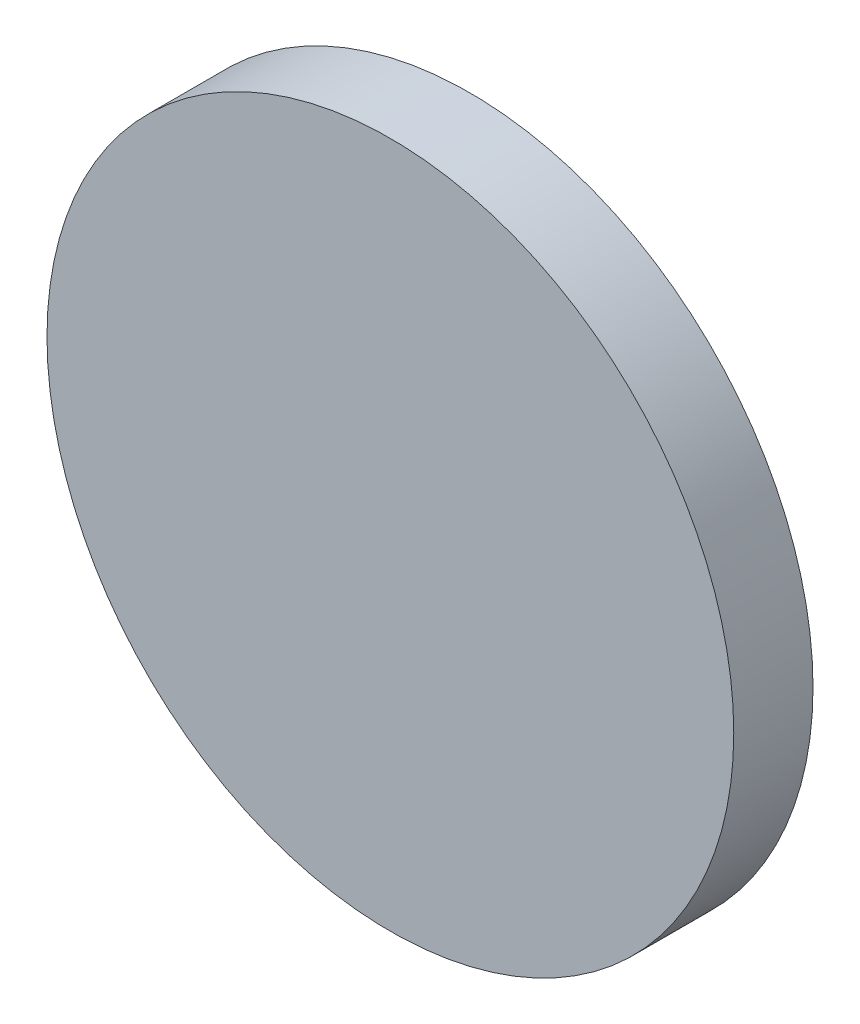
from build123d import *

# Parameters (mm, degrees)
SKETCH_1_R      = 13
EXTRUDE_1_DEPTH = 3


with BuildPart() as part:
    # 草图1 → 凸台-拉伸1 (new body)
    with BuildSketch(Plane.XY):
        Circle(SKETCH_1_R)
    extrude(amount=EXTRUDE_1_DEPTH)


solid = part.part
